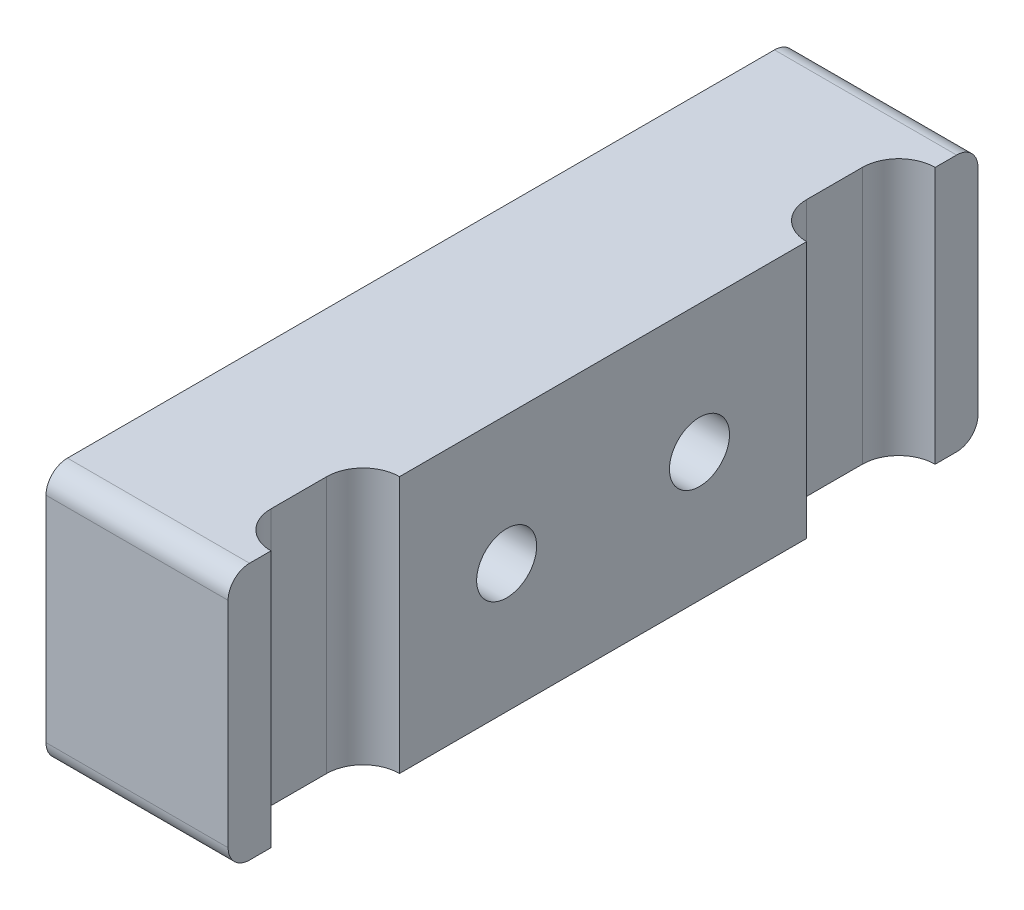
from build123d import *

# Parameters (mm, degrees)
BASE_DEPTH                = 12
CASE_MOUNTING_HOLES_REACH = 24.858
SKETCH2_R                 = 1.4
F_1MM_EDGE_FILLETS_R      = 1


with BuildPart() as part:
    # Sketch1 → Base (new body)
    with BuildSketch(Plane(origin=(0, 0, 0), x_dir=(1, 0, 0), z_dir=(0, 1, 0))):
        with BuildLine():
            Line((8.5, 17.5), (8.5, 15.5))
            ThreePointArc((8.5, 15.5), (7.297918472, 15.002081528), (6.8, 13.8))
            Line((6.8, 13.8), (6.8, 11.2))
            ThreePointArc((6.8, 11.2), (7.297918472, 9.997918472), (8.5, 9.5))
            Line((8.5, 9.5), (8.5, -9.5))
            ThreePointArc((8.5, -9.5), (7.297918472, -9.997918472), (6.8, -11.2))
            Line((6.8, -11.2), (6.8, -13.8))
            ThreePointArc((6.8, -13.8), (7.297918472, -15.002081528), (8.5, -15.5))
            Line((8.5, -15.5), (8.5, -17.5))
            Line((8.5, -17.5), (0, -17.5))
            Line((0, -17.5), (0, 17.5))
            Line((0, 17.5), (8.5, 17.5))
        make_face()
    extrude(amount=BASE_DEPTH)

    # Sketch2 → Case Mounting Holes (cut, up to next)
    with BuildSketch(Plane(origin=(8.5, 0, 0), x_dir=(0, 0, -1), z_dir=(1, 0, 0)), mode=Mode.PRIVATE) as case_mounting_holes_sk1:
        with Locations((-4.5, 6)):
            Circle(SKETCH2_R)
    case_mounting_holes_tool1 = extrude(case_mounting_holes_sk1.sketch, amount=-CASE_MOUNTING_HOLES_REACH, mode=Mode.PRIVATE) & part.part
    # Sketch2 → Case Mounting Holes (cut, up to next)
    with BuildSketch(Plane(origin=(8.5, 0, 0), x_dir=(0, 0, -1), z_dir=(1, 0, 0)), mode=Mode.PRIVATE) as case_mounting_holes_sk2:
        with Locations((4.5, 6)):
            Circle(SKETCH2_R)
    case_mounting_holes_tool2 = extrude(case_mounting_holes_sk2.sketch, amount=-CASE_MOUNTING_HOLES_REACH, mode=Mode.PRIVATE) & part.part
    add(case_mounting_holes_tool1.solids().sort_by_distance((8.5, 6, 4.5))[0], mode=Mode.SUBTRACT)
    add(case_mounting_holes_tool2.solids().sort_by_distance((8.5, 6, -4.5))[0], mode=Mode.SUBTRACT)

    # 1mm Edge Fillets
    f_1mm_edge_fillets_edges = [part.edges().sort_by_distance(p)[0] for p in [
        (4.25, 12, -17.5),
        (4.25, 0, -17.5),
        (4.25, 0, 17.5),
        (4.25, 12, 17.5),
    ]]
    fillet(f_1mm_edge_fillets_edges, radius=F_1MM_EDGE_FILLETS_R)


solid = part.part
